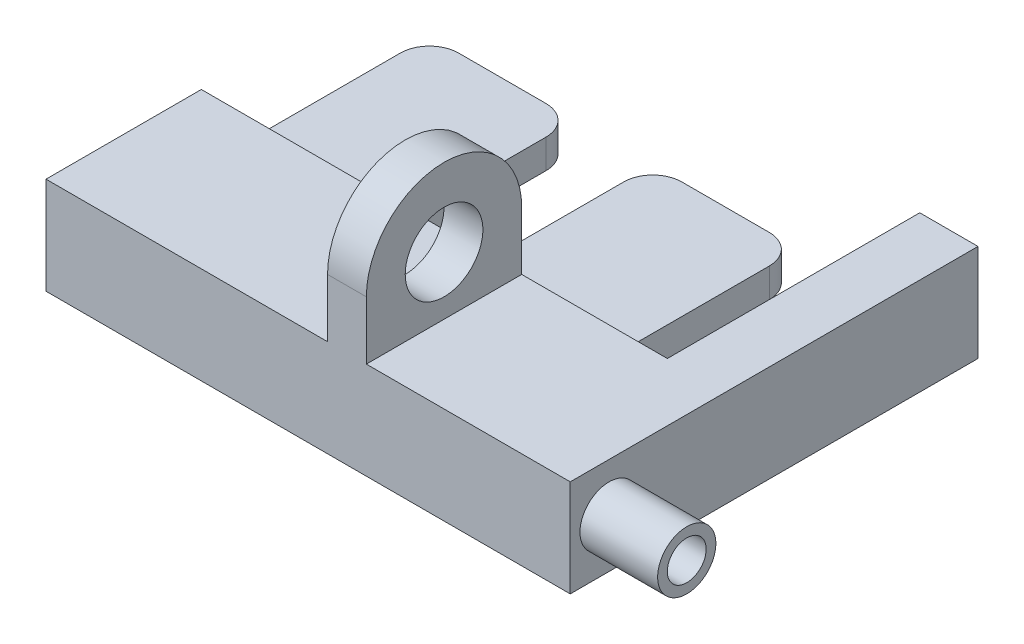
from build123d import *

# Parameters (mm, degrees)
SKETCH_1_W          = 27
SKETCH_1_H          = 5
EXTRUDE_1_DEPTH     = 8
SKETCH_2_W          = 3
SKETCH_2_H          = 5
EXTRUDE_2_DEPTH     = 13
SKETCH_3_R          = 0.5
CUT_EXTRUDE_1_DEPTH = 3
SKETCH_4_R          = 1.5
SKETCH_4_R_2        = 1
EXTRUDE_3_DEPTH     = 4
SKETCH_6_R          = 2
EXTRUDE_5_DEPTH     = 2
SKETCH_7_W          = 7.5
SKETCH_7_H          = 1.5
EXTRUDE_6_DEPTH     = 10
FILLET_1_R          = 1.5


with BuildPart() as part:
    # 草图1 → 凸台-拉伸1 (new body)
    with BuildSketch(Plane.XY):
        Rectangle(SKETCH_1_W, SKETCH_1_H)
    extrude(amount=EXTRUDE_1_DEPTH)

    # 草图2 → 凸台-拉伸2 (add)
    with BuildSketch(Plane(origin=(0, 0, 0), x_dir=(-1, 0, 0), z_dir=(0, 0, -1))):
        with Locations((-12, 0)):
            Rectangle(SKETCH_2_W, SKETCH_2_H)
    extrude(amount=EXTRUDE_2_DEPTH)

    # 草图3 → 切除-拉伸1 (cut)
    with BuildSketch(Plane(origin=(0, 0, -13), x_dir=(-1, 0, 0), z_dir=(0, 0, -1))):
        with Locations((-12, 1.3)):
            Circle(SKETCH_3_R)
        with Locations(Location((-12, -1.3, 0), (0, 0, 180))):
            Circle(SKETCH_3_R)
    extrude(amount=-CUT_EXTRUDE_1_DEPTH, mode=Mode.SUBTRACT)

    # 草图4 → 凸台-拉伸3 (add)
    with BuildSketch(Plane(origin=(13.5, 0, 0), x_dir=(0, 0, -1), z_dir=(1, 0, 0))):
        with Locations(Location((-6, 0, 0), (0, 0, 180))):
            Circle(SKETCH_4_R)
        with Locations((-6, 0)):
            Circle(SKETCH_4_R_2, mode=Mode.SUBTRACT)
    extrude(amount=EXTRUDE_3_DEPTH)

    # 草图6 → 凸台-拉伸5 (add)
    with BuildSketch(Plane.ZY.offset(-1)):
        with BuildLine():
            Line((8, 2.5), (0, 2.5))
            Line((0, 2.5), (0, 5.5))
            ThreePointArc((0, 5.5), (4, 9.5), (8, 5.5))
            Line((8, 5.5), (8, 2.5))
        make_face()
        with Locations((4, 5.5)):
            Circle(SKETCH_6_R, mode=Mode.SUBTRACT)
    extrude(amount=-EXTRUDE_5_DEPTH)

    # 草图7 → 凸台-拉伸6 (add)
    with BuildSketch(Plane(origin=(0, 0, 0), x_dir=(-1, 0, 0), z_dir=(0, 0, -1))):
        with Locations((-3.5, 0)):
            Rectangle(SKETCH_7_W, SKETCH_7_H)
        with Locations((8, 0)):
            Rectangle(SKETCH_7_W, SKETCH_7_H)
    extrude(amount=EXTRUDE_6_DEPTH)

    # 圆角1
    fillet_1_edges = [part.edges().sort_by_distance(p)[0] for p in [
        (7.25, 0, -10),
        (-0.25, 0, -10),
        (-4.25, 0, -10),
        (-11.75, 0, -10),
    ]]
    fillet(fillet_1_edges, radius=FILLET_1_R)


solid = part.part
